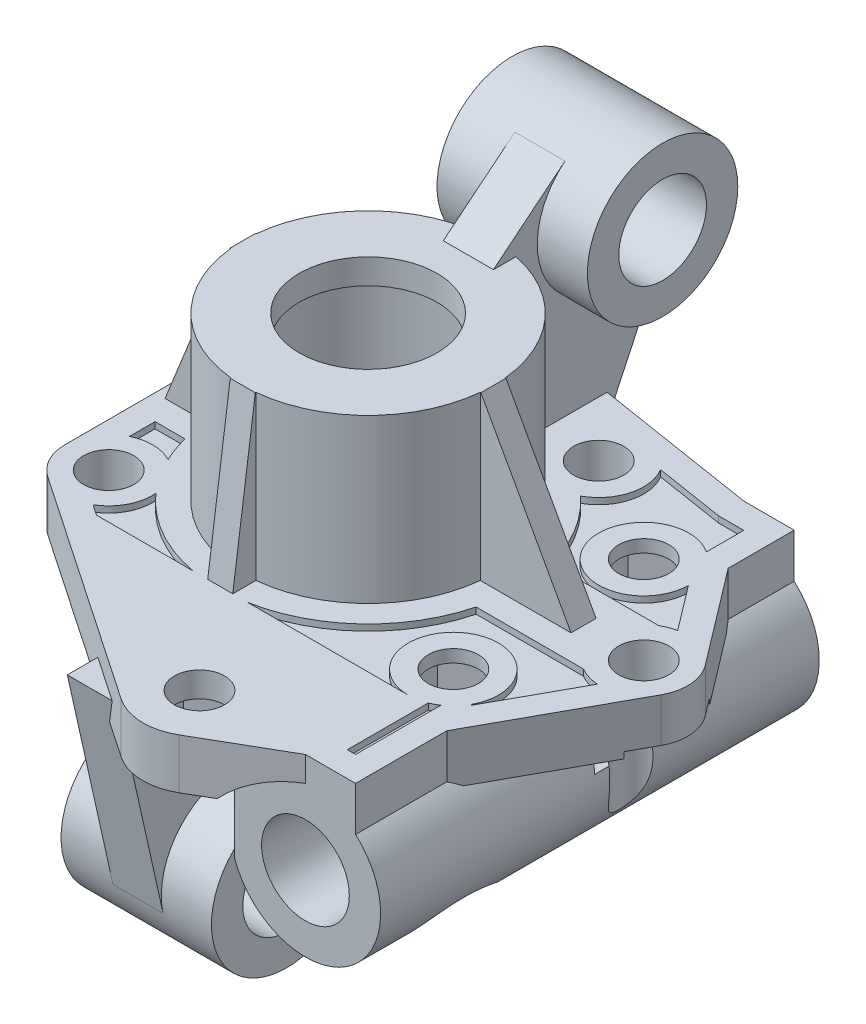
from build123d import *

# Parameters (mm, degrees)
SKETCH4_R                      = 10
BOSS_EXTRUDE5_DEPTH            = 15
SKETCH8_R                      = 3.5
BOSS_EXTRUDE6_DEPTH            = 2
BOSS_EXTRUDE10_DEPTH           = 20
BOSS_EXTRUDE10_DEPTH_BACK      = 15
SKETCH16_R                     = 3.5
SKETCH19_R                     = 2
BOSS_EXTRUDE_FLANGE_DEPTH      = 2
CUT_EXTRUDE3_DEPTH             = 42.007814013
CUT_EXTRUDE3_DEPTH_BACK        = 42.007814013
SKETCH10_R                     = 3.5
SKETCH11_R                     = 6
SKETCH11_R_2                   = 3.5
BOSS_EXTRUDE7_DEPTH            = 6
SKETCH12_R                     = 6
CUT_EXTRUDE4_DEPTH             = 45.984895402
SKETCH14_R                     = 6
CUT_EXTRUDE5_DEPTH             = 39.928020941
SKETCH17_R                     = 6
CUT_EXTRUDE6_DEPTH             = 6
CUT_EXTRUDE7_START             = 6
SKETCH18_R                     = 6
CUT_EXTRUDE7_DEPTH             = 6
BOSS_EXTRUDE13_DEPTH           = 1
BOSS_EXTRUDE12_DEPTH           = 1
CUT_EXTRUDE_BEARING_DEPTH      = 13
CUT_EXTRUDE_BEARING_DEPTH_BACK = 13
SKETCH7_R                      = 7.75
CUT_EXTRUDE_SHAFT_DEPTH        = 42.007814065
CUT_EXTRUDE_SHAFT_DEPTH_BACK   = 42.007814065
SKETCH26_R                     = 5.5
CUT_EXTRUDE8_REACH             = 44.067
CUT_EXTRUDE8_END_RADIUS        = 3.5
SKETCH20_R                     = 2
CUT_EXTRUDE10_DEPTH            = 1
CUT_EXTRUDE10_DEPTH_BACK       = 2
CUT_EXTRUDE15_START            = -2
CUT_EXTRUDE15_DEPTH            = 7.999588
CUT_EXTRUDE18_DEPTH            = 43.067098904
CUT_EXTRUDE18_DEPTH_BACK       = 43.067098904
SKETCH33_R                     = 2
CUT_EXTRUDE17_DEPTH            = 0.3
CUT_EXTRUDE17_DEPTH_BACK       = 0.5
CUT_EXTRUDE19_DEPTH            = 3
CUT_EXTRUDE20_DEPTH            = 0.5
SKETCH37_R                     = 3.6
CUT_EXTRUDE21_DEPTH            = 43.067098904


with BuildPart() as part:
    # Sketch4 → Boss-Extrude5 (new, symmetric)
    with BuildSketch(Plane(origin=(0, 0, 0), x_dir=(1, 0, 0), z_dir=(0, 1, 0))):
        with Locations(Location((0, 0, 0), (0, 0, 270))):
            Circle(SKETCH4_R)
    extrude(amount=BOSS_EXTRUDE5_DEPTH, both=True)

    # Sketch8 → Boss-Extrude6 (add, symmetric)
    # profile 1 of 2: a face of its own
    with BuildSketch(Plane(origin=(0, 0, 0), x_dir=(0, 0, -1), z_dir=(1, 0, 0))):
        with BuildLine():
            Line((13.710526316, 19.65186943), (8, 15))
            Line((8, 15), (8, 0))
            Line((8, 0), (17.06621069, 0))
            Line((17.06621069, 0), (22.927881906, 12.443029524))
            ThreePointArc((22.927881906, 12.443029524), (21.196341242, 19.726210049), (13.710526316, 19.65186943))
        make_face()
        with Locations((17.5, 15)):
            Circle(SKETCH8_R, mode=Mode.SUBTRACT)
    # profile 2 of 2: a face of its own
    with BuildSketch(Plane(origin=(0, 0, 0), x_dir=(0, 0, -1), z_dir=(1, 0, 0))):
        with BuildLine():
            Line((-18.355574138, -16.308530287), (-22, 0))
            Line((-22, 0), (-6.5, 0))
            Line((-6.5, 0), (-6.5, -15))
            ThreePointArc((-6.5, -15), (-11.841761756, -20.963784236), (-18.355574138, -16.308530287))
        make_face()
        with Locations((-12.5, -15)):
            Circle(SKETCH8_R, mode=Mode.SUBTRACT)
    extrude(amount=BOSS_EXTRUDE6_DEPTH, both=True)

    # Sketch16 → Boss-Extrude10 (add, two sides: drawn at the far end of the back side and taken through both)
    with BuildSketch(Plane.XY.offset(-BOSS_EXTRUDE10_DEPTH_BACK)):
        with BuildLine():
            Line((9, -6), (9, 2))
            Line((9, 2), (19, 2))
            Line((19, 2), (19, -1.527864045))
            ThreePointArc((19, -1.527864045), (17.449489743, -11.477225575), (9, -6))
        make_face()
        with Locations((15, -6)):
            Circle(SKETCH16_R, mode=Mode.SUBTRACT)
    extrude(amount=BOSS_EXTRUDE10_DEPTH + BOSS_EXTRUDE10_DEPTH_BACK)

    # Sketch19 → Boss-Extrude Flange (add, symmetric)
    with BuildSketch(Plane(origin=(0, 0, 0), x_dir=(1, 0, 0), z_dir=(0, 1, 0))):
        with BuildLine():
            Line((2, 17.06621069), (15, 15))
            Line((15, 15), (24.786975214, 2.1172551))
            ThreePointArc((24.786975214, 2.1172551), (25.49054164, 0.257136266), (25.067148147, -1.686001852))
            Line((25.067148147, -1.686001852), (15, -20))
            Line((15, -20), (8.591170231, -23.696129133))
            ThreePointArc((8.591170231, -23.696129133), (6.176763185, -24.294887403), (3.813153782, -23.519501409))
            Line((3.813153782, -23.519501409), (-14.467658169, -11.092491978))
            ThreePointArc((-14.467658169, -11.092491978), (-15.593283336, -9.835517582), (-16, -8.197958971))
            Line((-16, -8.197958971), (-16, 8.197958971))
            ThreePointArc((-16, 8.197958971), (-15.458921928, 10.067392315), (-14.002982271, 11.358820292))
            Line((-14.002982271, 11.358820292), (-2, 17.06621069))
            Line((-2, 17.06621069), (2, 17.06621069))
        make_face()
        with Locations(Location((6.343, -19.797958971, 0), (0, 0, 270))):
            Circle(SKETCH19_R, mode=Mode.SUBTRACT)
        with Locations(Location((-12.5, 8.197958971, 0), (0, 0, 270))):
            Circle(SKETCH19_R, mode=Mode.SUBTRACT)
        with Locations(Location((-12.5, -8.197958971, 0), (0, 0, 270))):
            Circle(SKETCH19_R, mode=Mode.SUBTRACT)
        with Locations(Location((6.4, 12, 0), (0, 0, 270))):
            Circle(SKETCH19_R, mode=Mode.SUBTRACT)
        with Locations(Location((22, 0, 0), (0, 0, 270))):
            Circle(SKETCH19_R, mode=Mode.SUBTRACT)
    extrude(amount=BOSS_EXTRUDE_FLANGE_DEPTH, both=True)

    # Sketch10 → Cut-Extrude3 (cut, two sides: drawn at the far end of the back side and taken through both)
    with BuildSketch(Plane(origin=(0, 0, 0), x_dir=(0, 0, -1), z_dir=(1, 0, 0)).offset(-CUT_EXTRUDE3_DEPTH_BACK)):
        with Locations((17.5, 15)):
            Circle(SKETCH10_R)
        with Locations((-12.5, -15)):
            Circle(SKETCH10_R)
    extrude(amount=CUT_EXTRUDE3_DEPTH + CUT_EXTRUDE3_DEPTH_BACK, mode=Mode.SUBTRACT)

    # Sketch11 → Boss-Extrude7 (add, symmetric)
    # profile 1 of 2: a face of its own
    with BuildSketch(Plane(origin=(0, 0, 0), x_dir=(0, 0, -1), z_dir=(1, 0, 0))):
        with Locations((17.5, 15)):
            Circle(SKETCH11_R)
        with Locations((17.5, 15)):
            Circle(SKETCH11_R_2, mode=Mode.SUBTRACT)
    # profile 2 of 2: a face of its own
    with BuildSketch(Plane(origin=(0, 0, 0), x_dir=(0, 0, -1), z_dir=(1, 0, 0))):
        with Locations((-12.5, -15)):
            Circle(SKETCH11_R)
        with Locations((-12.5, -15)):
            Circle(SKETCH11_R_2, mode=Mode.SUBTRACT)
    extrude(amount=BOSS_EXTRUDE7_DEPTH, both=True)

    # Sketch12 → Cut-Extrude4 (cut, through all)
    with BuildSketch(Plane.ZY.offset(6)):
        with Locations((12.5, -15)):
            Circle(SKETCH12_R)
    extrude(amount=CUT_EXTRUDE4_DEPTH, mode=Mode.SUBTRACT)

    # Sketch14 → Cut-Extrude5 (cut, through all)
    with BuildSketch(Plane(origin=(6, 0, 0), x_dir=(0, 0, -1), z_dir=(1, 0, 0))):
        with Locations((-12.5, -15)):
            Circle(SKETCH14_R)
    extrude(amount=CUT_EXTRUDE5_DEPTH, mode=Mode.SUBTRACT)

    # Sketch17 → Cut-Extrude6 (cut)
    with BuildSketch(Plane.XY.offset(20)):
        with Locations((15, -6)):
            Circle(SKETCH17_R)
    extrude(amount=CUT_EXTRUDE6_DEPTH, mode=Mode.SUBTRACT)

    # Sketch18 → Cut-Extrude7 (cut)
    with BuildSketch(Plane(origin=(0, 0, -15), x_dir=(-1, 0, 0), z_dir=(0, 0, -1)).offset(CUT_EXTRUDE7_START)):
        with Locations((-15, -6)):
            Circle(SKETCH18_R)
    extrude(amount=-CUT_EXTRUDE7_DEPTH, mode=Mode.SUBTRACT)

    # Sketch25 → Boss-Extrude13 (add, symmetric)
    with BuildSketch(Plane(origin=(0, 0, 0), x_dir=(0, 0, -1), z_dir=(1, 0, 0))):
        Polygon((0, 15), (-10, 15), (-11.797958971, 2), (0, 2), align=None)
        Polygon((0, 0), (17.06621069, 0), (17.06621069, -2), (10, -15), (0, -15), align=None)
    extrude(amount=BOSS_EXTRUDE13_DEPTH, both=True)

    # Sketch22 → Boss-Extrude12 (add, symmetric)
    with BuildSketch(Plane.XY):
        with BuildLine():
            Line((0, -15), (0, 0))
            Line((0, 0), (-16, 0))
            Line((-16, 0), (-10, 15))
            Line((-10, 15), (10, 15))
            Line((10, 15), (18.3, 0))
            Line((18.3, 0), (15, 0))
            Line((15, 0), (15, -2.5))
            ThreePointArc((15, -2.5), (11.5, -6), (15, -9.5))
            Line((15, -9.5), (15, -12))
            Line((15, -12), (10, -15))
            Line((10, -15), (0, -15))
        make_face()
    extrude(amount=BOSS_EXTRUDE12_DEPTH, both=True)

    # Sketch7 → Cut-Extrude Bearing (cut, two sides: drawn at the far end of the back side and taken through both)
    with BuildSketch(Plane(origin=(0, 0, 0), x_dir=(1, 0, 0), z_dir=(0, 1, 0)).offset(-CUT_EXTRUDE_BEARING_DEPTH_BACK)):
        with Locations(Location((0, 0, 0), (0, 0, 270))):
            Circle(SKETCH7_R)
    extrude(amount=CUT_EXTRUDE_BEARING_DEPTH + CUT_EXTRUDE_BEARING_DEPTH_BACK, mode=Mode.SUBTRACT)

    # Sketch26 → Cut-Extrude Shaft (cut, two sides: drawn at the far end of the back side and taken through both)
    with BuildSketch(Plane(origin=(0, 0, 0), x_dir=(1, 0, 0), z_dir=(0, 1, 0)).offset(-CUT_EXTRUDE_SHAFT_DEPTH_BACK)):
        with Locations(Location((0, 0, 0), (0, 0, 270))):
            Circle(SKETCH26_R)
    extrude(amount=CUT_EXTRUDE_SHAFT_DEPTH + CUT_EXTRUDE_SHAFT_DEPTH_BACK, mode=Mode.SUBTRACT)

    # Cut-Extrude8: up to this cylinder (the profile starts outside it)
    cut_extrude8_end = Plane(origin=(15, -6, 0.5989795), z_dir=(0, 0, 1)) * Cylinder(CUT_EXTRUDE8_END_RADIUS, 111.331959, mode=Mode.PRIVATE)
    # Sketch20 → Cut-Extrude8 (cut, up to the surface)
    with BuildSketch(Plane(origin=(0, 2, 0), x_dir=(1, 0, 0), z_dir=(0, 1, 0)), mode=Mode.PRIVATE) as cut_extrude8_sk1:
        with Locations(Location((15, 7, 0), (0, 0, 270))):
            Circle(SKETCH20_R)
    cut_extrude8_tool1 = extrude(cut_extrude8_sk1.sketch, amount=-CUT_EXTRUDE8_REACH, mode=Mode.PRIVATE) - cut_extrude8_end
    add(cut_extrude8_tool1.solids().sort_by_distance((15, 2, -7))[0], mode=Mode.SUBTRACT)
    # Sketch20 → Cut-Extrude8 (cut, up to the surface)
    with BuildSketch(Plane(origin=(0, 2, 0), x_dir=(1, 0, 0), z_dir=(0, 1, 0)), mode=Mode.PRIVATE) as cut_extrude8_sk2:
        with Locations(Location((15, -8.197958971, 0), (0, 0, 270))):
            Circle(SKETCH20_R)
    cut_extrude8_tool2 = extrude(cut_extrude8_sk2.sketch, amount=-CUT_EXTRUDE8_REACH, mode=Mode.PRIVATE) - cut_extrude8_end
    add(cut_extrude8_tool2.solids().sort_by_distance((15, 2, 8.197959))[0], mode=Mode.SUBTRACT)

    # Sketch21 → Cut-Extrude10 (cut, two sides: drawn at the far end of the back side and taken through both)
    with BuildSketch(Plane(origin=(0, 0, 0), x_dir=(1, 0, 0), z_dir=(0, 1, 0)).offset(-CUT_EXTRUDE10_DEPTH_BACK)):
        Polygon((15, 3.535898385), (18, 5.267949192), (18, 8.732050808), (15, 10.464101615), (12, 8.732050808), (12, 5.267949192), align=None)
        Polygon((15, -11.662060586), (18, -9.930009779), (18, -6.465908164), (15, -4.733857356), (12, -6.465908164), (12, -9.930009779), align=None)
    extrude(amount=CUT_EXTRUDE10_DEPTH + CUT_EXTRUDE10_DEPTH_BACK, mode=Mode.SUBTRACT)

    # Sketch30 → Cut-Extrude15 (cut)
    with BuildSketch(Plane.XZ.offset(2).offset(CUT_EXTRUDE15_START)):
        Polygon((6.343, 23.262060586), (3.343, 21.530009779), (3.343, 18.065908164), (6.343, 16.333857356), (9.343, 18.065908164), (9.343, 21.530009779), align=None)
    extrude(amount=CUT_EXTRUDE15_DEPTH, mode=Mode.SUBTRACT)

    # Sketch33 → Cut-Extrude18 (cut, two sides: drawn at the far end of the back side and taken through both)
    with BuildSketch(Plane.XZ.offset(2).offset(-CUT_EXTRUDE18_DEPTH_BACK)):
        with Locations(Location((22, 0, 0), (0, 0, 90))):
            Circle(SKETCH33_R)
    extrude(amount=CUT_EXTRUDE18_DEPTH + CUT_EXTRUDE18_DEPTH_BACK, mode=Mode.SUBTRACT)

    # Sketch32 → Cut-Extrude17 (cut, two sides: drawn at the far end of the back side and taken through both)
    with BuildSketch(Plane.XZ.offset(2).offset(-CUT_EXTRUDE17_DEPTH_BACK)):
        with BuildLine():
            Line((22, 3.6), (25.6, 3.6))
            Line((25.6, 3.6), (25.6, -3.6))
            Line((25.6, -3.6), (22, -3.6))
            ThreePointArc((22, -3.6), (18.4, 0), (22, 3.6))
        make_face()
    extrude(amount=CUT_EXTRUDE17_DEPTH + CUT_EXTRUDE17_DEPTH_BACK, mode=Mode.SUBTRACT)

    # Sketch35 → Cut-Extrude19 (cut)
    with BuildSketch(Plane.XZ.offset(2)):
        Polygon((22, -3.464101615), (25, -1.732050808), (25, 1.732050808), (22, 3.464101615), (19, 1.732050808), (19, -1.732050808), align=None)
    extrude(amount=CUT_EXTRUDE19_DEPTH, mode=Mode.SUBTRACT)

    # Sketch36 → Cut-Extrude20 (cut)
    with BuildSketch(Plane(origin=(0, 2, 0), x_dir=(1, 0, 0), z_dir=(0, 1, 0))):
        with BuildLine():
            ThreePointArc((-9.010647141, 7.925164863), (-6.72233529, 9.940332401), (-4, 11.313708499))
            Line((-4, 11.313708499), (-4, 13.900629057))
            Line((-4, 13.900629057), (-10.288272075, 10.910570183))
            ThreePointArc((-10.288272075, 10.910570183), (-9.28227693, 9.575005899), (-9.010647141, 7.925164863))
        make_face()
        with BuildLine():
            Line((17, 9.993325909), (17, 12.974895859))
            Line((17, 12.974895859), (15, 12.974895859))
            Line((15, 12.974895859), (9.487672301, 13.851021275))
            ThreePointArc((9.487672301, 13.851021275), (9.872885533, 11.05180905), (8.118635586, 8.836727688))
            ThreePointArc((8.118635586, 8.836727688), (10.291254496, 6.171716204), (11.618950039, 3))
            Line((11.618950039, 3), (20.197224362, 3))
            ThreePointArc((20.197224362, 3), (20.721521087, 3.258142365), (21.281461234, 3.425449174))
            Line((21.281461234, 3.425449174), (18.599724463, 6.955460229))
            ThreePointArc((18.599724463, 6.955460229), (11.814660852, 5.322616766), (17, 9.993325909))
        make_face()
        with BuildLine():
            Line((18.229459881, -9.973183081), (21.791176066, -3.493764812))
            ThreePointArc((21.791176066, -3.493764812), (20.964343623, -3.343264253), (20.197224362, -3))
            Line((20.197224362, -3), (11.618950039, -3))
            ThreePointArc((11.618950039, -3), (8.18790591, -8.772582106), (2.192752634, -11.797958971))
            Line((2.192752634, -11.797958971), (15, -11.797958971))
            ThreePointArc((15, -11.797958971), (13.1673822, -5.099328306), (18.154780951, -9.932132304))
            Line((18.154780951, -9.932132304), (18.229459881, -9.973183081))
        make_face()
        with BuildLine():
            Line((16.343, -11.538071394), (16.343, -18))
            Line((16.343, -18), (17, -18))
            Line((17, -18), (17, -11.191284881))
            ThreePointArc((17, -11.191284881), (16.68046942, -11.381671039), (16.343, -11.538071394))
        make_face()
        with BuildLine():
            Line((-9.872349066, -11.797958971), (-2.192752634, -11.797958971))
            ThreePointArc((-2.192752634, -11.797958971), (-5.926944844, -10.434142265), (-9.010647141, -7.925164863))
            ThreePointArc((-9.010647141, -7.925164863), (-9.397070701, -9.817165495), (-10.728048625, -11.216267823))
            Line((-10.728048625, -11.216267823), (-9.872349066, -11.797958971))
        make_face()
        with BuildLine():
            Line((-11.618950039, -3), (-14, -3))
            Line((-14, -3), (-14, -5.035681311))
            ThreePointArc((-14, -5.035681311), (-12.421307841, -4.69884372), (-10.85935449, -5.106311787))
            ThreePointArc((-10.85935449, -5.106311787), (-11.288386995, -4.070911329), (-11.618950039, -3))
        make_face()
    extrude(amount=-CUT_EXTRUDE20_DEPTH, mode=Mode.SUBTRACT)

    # Sketch37 → Cut-Extrude21 (cut, through all)
    with BuildSketch(Plane.XZ.offset(2)):
        with Locations((6.4, -12)):
            Circle(SKETCH37_R)
    extrude(amount=CUT_EXTRUDE21_DEPTH, mode=Mode.SUBTRACT)


solid = part.part
